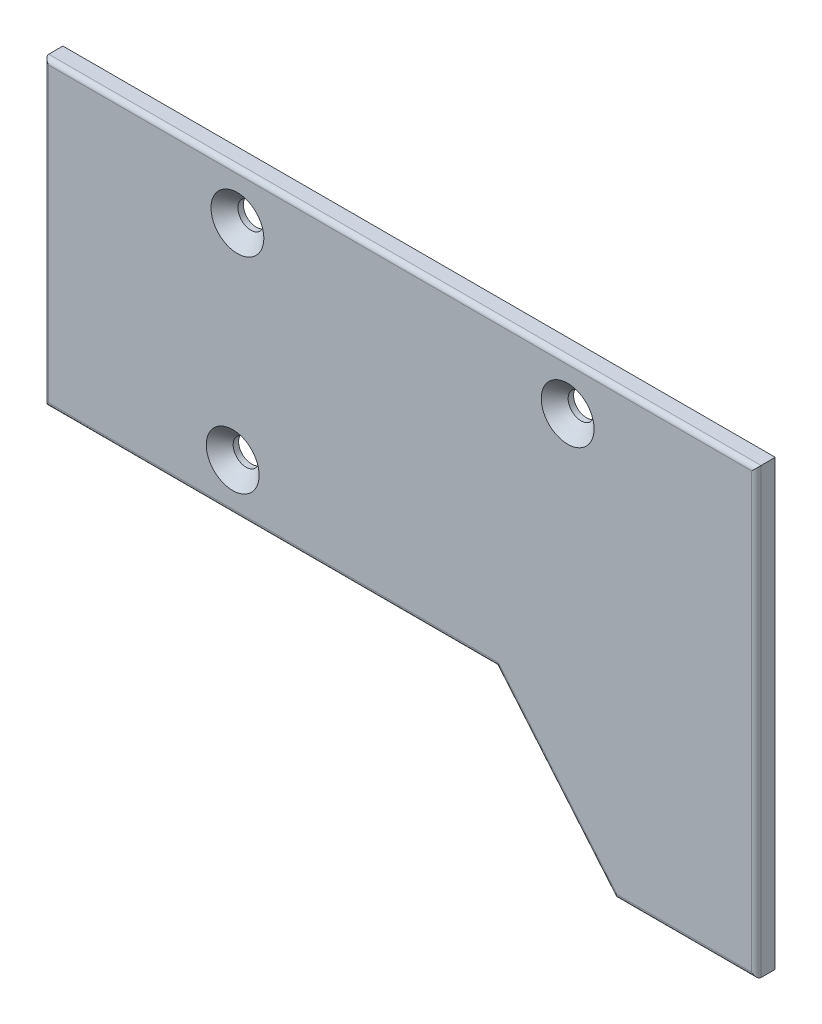
from build123d import *

# Parameters (mm, degrees)
SKETCH1_R                                            = 2.75
BOSS_EXTRUDE1_DEPTH                                  = 4
FILLET1_R                                            = 1
CSK_FOR_M5_HEX_SOCKET_COUNTERSUNK_CAP_SC_D           = 5.5
CSK_FOR_M5_HEX_SOCKET_COUNTERSUNK_CAP_SC_DEPTH       = 12.4
CSK_FOR_M5_HEX_SOCKET_COUNTERSUNK_CAP_SC_CSINK_D     = 11.2
CSK_FOR_M5_HEX_SOCKET_COUNTERSUNK_CAP_SC_CSINK_ANGLE = 90
CSK_FOR_M5_HEX_SOCKET_COUNTERSUNK_CAP_SC_TIP         = 1.652366702


with BuildPart() as part:
    # Sketch1 → Boss-Extrude1 (new body)
    with BuildSketch(Plane.XY):
        Polygon((0, 0), (0, 64), (151, 64), (151, -30), (121, -30), (95.827011065, 0), align=None)
        with Locations((41, 54)):
            Circle(SKETCH1_R, mode=Mode.SUBTRACT)
        with Locations((111, 54)):
            Circle(SKETCH1_R, mode=Mode.SUBTRACT)
        with Locations((40, 10)):
            Circle(SKETCH1_R, mode=Mode.SUBTRACT)
    extrude(amount=BOSS_EXTRUDE1_DEPTH)

    # Fillet1
    fillet1_edges = [part.edges().sort_by_distance(p)[0] for p in [
        (136, -30, 4),
        (151, 17, 4),
        (75.5, 64, 4),
        (0, 32, 4),
        (47.913505532, 0, 4),
        (108.413505532, -15, 4),
    ]]
    fillet(fillet1_edges, radius=FILLET1_R)

    # CSK for M5 Hex Socket Countersunk Cap Screw1
    with Locations(Plane.XY.offset(4)):
        with Locations((41, 54), (111, 54), (40, 10)):
            CounterSinkHole(CSK_FOR_M5_HEX_SOCKET_COUNTERSUNK_CAP_SC_D / 2, CSK_FOR_M5_HEX_SOCKET_COUNTERSUNK_CAP_SC_CSINK_D / 2, depth=CSK_FOR_M5_HEX_SOCKET_COUNTERSUNK_CAP_SC_DEPTH, counter_sink_angle=CSK_FOR_M5_HEX_SOCKET_COUNTERSUNK_CAP_SC_CSINK_ANGLE)
            with Locations((0, 0, -(CSK_FOR_M5_HEX_SOCKET_COUNTERSUNK_CAP_SC_DEPTH + CSK_FOR_M5_HEX_SOCKET_COUNTERSUNK_CAP_SC_TIP / 2))):  # 118° drill point
                Cone(0, CSK_FOR_M5_HEX_SOCKET_COUNTERSUNK_CAP_SC_D / 2, CSK_FOR_M5_HEX_SOCKET_COUNTERSUNK_CAP_SC_TIP, mode=Mode.SUBTRACT)


solid = part.part
